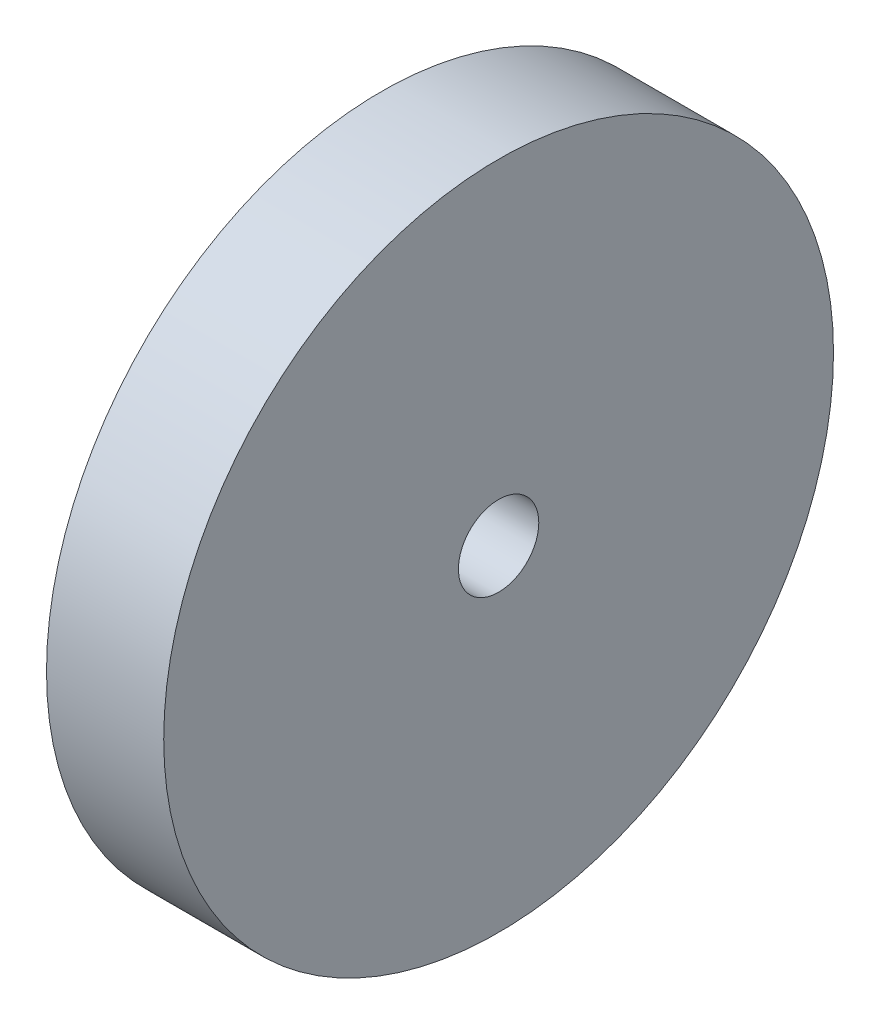
from build123d import *

# Parameters (mm, degrees)
SKETCH1_R           = 50
SKETCH1_R_2         = 6
BOSS_EXTRUDE1_DEPTH = 17.5


with BuildPart() as part:
    # Sketch1 → Boss-Extrude1 (new body)
    with BuildSketch(Plane(origin=(0, 0, 0), x_dir=(0, 0, -1), z_dir=(1, 0, 0))):
        Circle(SKETCH1_R)
        Circle(SKETCH1_R_2, mode=Mode.SUBTRACT)
    extrude(amount=BOSS_EXTRUDE1_DEPTH)


solid = part.part
